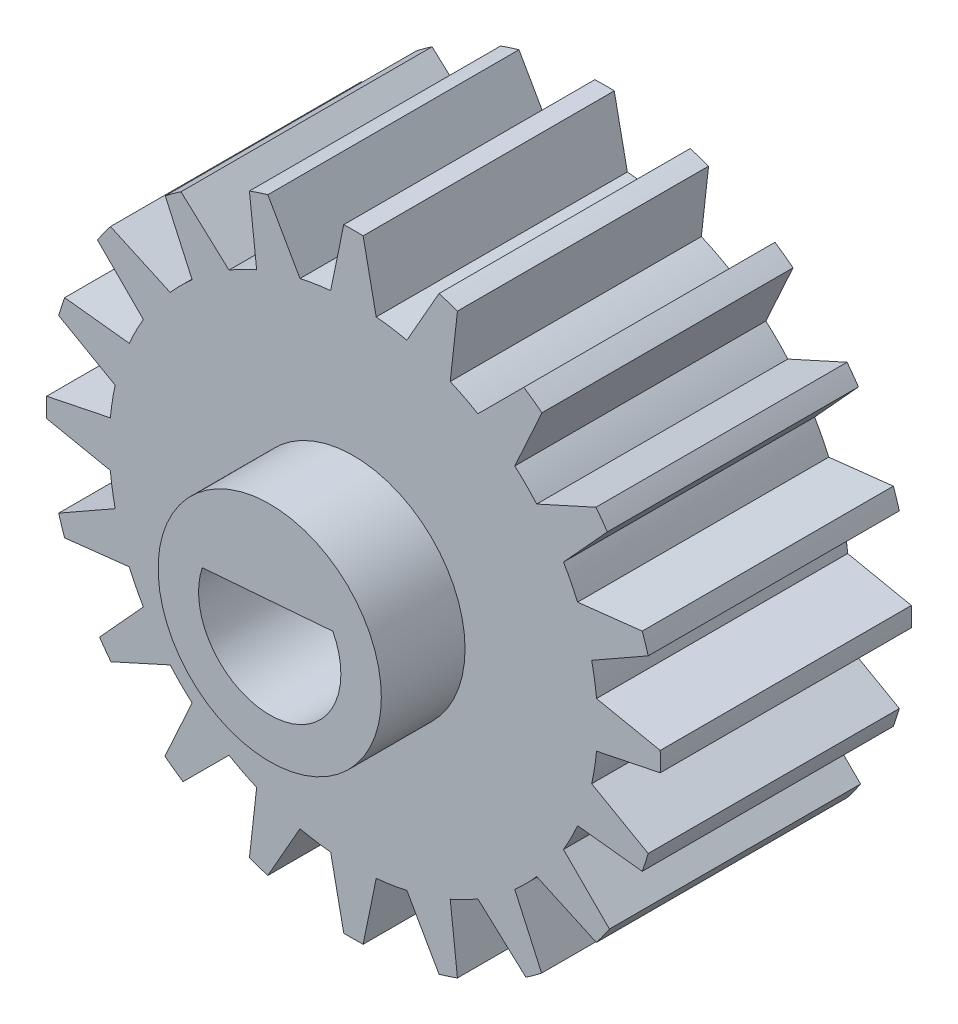
from build123d import *

# Parameters (mm, degrees)
SKETCH_1_R       = 8
EXTRUDE_1_DEPTH  = 24
SKETCH_2_R       = 17.5
SKETCH_2_R_2     = 8
EXTRUDE_2_DEPTH  = 18
EXTRUDE_3_DEPTH  = 18
EXTRUDE_4_DEPTH  = 18
EXTRUDE_5_DEPTH  = 18
EXTRUDE_6_DEPTH  = 18
EXTRUDE_7_DEPTH  = 18
EXTRUDE_8_DEPTH  = 18
EXTRUDE_9_DEPTH  = 18
EXTRUDE_10_DEPTH = 18
EXTRUDE_11_DEPTH = 18
EXTRUDE_12_DEPTH = 18
EXTRUDE_13_DEPTH = 18
EXTRUDE_14_DEPTH = 18
EXTRUDE_15_DEPTH = 18
EXTRUDE_16_DEPTH = 18
EXTRUDE_17_DEPTH = 18
EXTRUDE_18_DEPTH = 18
EXTRUDE_19_DEPTH = 18
EXTRUDE_20_DEPTH = 18
EXTRUDE_21_DEPTH = 18
EXTRUDE_22_DEPTH = 18


with BuildPart() as part:
    # 草图1 → 凸台-拉伸1 (new body)
    with BuildSketch(Plane.XY):
        Circle(SKETCH_1_R)
        with BuildLine():
            Line((4.520101179, 2.361924075), (-4.833937562, 1.62574526))
            ThreePointArc((-4.833937562, 1.62574526), (0.400141388, -5.084278402), (4.520101179, 2.361924075))
        make_face(mode=Mode.SUBTRACT)
    extrude(amount=EXTRUDE_1_DEPTH)

    # 草图2 → 凸台-拉伸2 (add)
    with BuildSketch(Plane.XY):
        Circle(SKETCH_2_R)
        Circle(SKETCH_2_R_2, mode=Mode.SUBTRACT)
    extrude(amount=EXTRUDE_2_DEPTH)

    # 草图3 → 凸台-拉伸3 (add)
    with BuildSketch(Plane.XY):
        with BuildLine():
            Line((17.423652167, 1.632894724), (21.989026862, 0.69476445))
            ThreePointArc((21.989026862, 0.69476445), (22, 0), (21.989026862, -0.69476445))
            Line((21.989026862, -0.69476445), (17.423652167, -1.632894724))
            ThreePointArc((17.423652167, -1.632894724), (17.5, 0), (17.423652167, 1.632894724))
        make_face()
    extrude(amount=EXTRUDE_3_DEPTH)

    # 草图4 → 凸台-拉伸4 (add)
    with BuildSketch(Plane.XY):
        with BuildLine():
            Line((16.066285711, 6.937179791), (20.698113262, 7.455743248))
            ThreePointArc((20.698113262, 7.455743248), (20.923243358, 6.798373876), (21.127501307, 6.134222733))
            Line((21.127501307, 6.134222733), (17.07547015, 3.831229456))
            ThreePointArc((17.07547015, 3.831229456), (16.643489035, 5.407797402), (16.066285711, 6.937179791))
        make_face()
    extrude(amount=EXTRUDE_4_DEPTH)

    # 草图5 → 凸台-拉伸5 (add)
    with BuildSketch(Plane.XY):
        with BuildLine():
            Line((13.13623927, 11.562405366), (17.381124124, 13.486901949))
            ThreePointArc((17.381124124, 13.486901949), (17.798373876, 12.93127555), (18.197868719, 12.362749455))
            Line((18.197868719, 12.362749455), (15.055822144, 8.920326203))
            ThreePointArc((15.055822144, 8.920326203), (14.157797402, 10.286241915), (13.13623927, 11.562405366))
        make_face()
    extrude(amount=EXTRUDE_5_DEPTH)

    # 草图6 → 凸台-拉伸6 (add)
    with BuildSketch(Plane.XY):
        with BuildLine():
            Line((8.920326203, 15.055822144), (12.212561116, 18.348057057))
            ThreePointArc((12.212561116, 18.348057057), (12.870731845, 17.892515435), (13.511927681, 17.413375811))
            Line((13.511927681, 17.413375811), (11.562405366, 13.13623927))
            ThreePointArc((11.562405366, 13.13623927), (10.286241915, 14.157797402), (8.920326203, 15.055822144))
        make_face()
    extrude(amount=EXTRUDE_6_DEPTH)

    # 草图7 → 凸台-拉伸7 (add)
    with BuildSketch(Plane.XY):
        with BuildLine():
            Line((3.831229456, 17.07547015), (6.134222733, 21.127501307))
            ThreePointArc((6.134222733, 21.127501307), (6.798373876, 20.923243358), (7.455743248, 20.698113262))
            Line((7.455743248, 20.698113262), (6.937179791, 16.066285711))
            ThreePointArc((6.937179791, 16.066285711), (5.407797402, 16.643489035), (3.831229456, 17.07547015))
        make_face()
    extrude(amount=EXTRUDE_7_DEPTH)

    # 草图8 → 凸台-拉伸8 (add)
    with BuildSketch(Plane.XY):
        with BuildLine():
            Line((-1.632894724, 17.423652167), (-0.69476445, 21.989026862))
            ThreePointArc((-0.69476445, 21.989026862), (0, 22), (0.69476445, 21.989026862))
            Line((0.69476445, 21.989026862), (1.632894724, 17.423652167))
            ThreePointArc((1.632894724, 17.423652167), (0, 17.5), (-1.632894724, 17.423652167))
        make_face()
    extrude(amount=EXTRUDE_8_DEPTH)

    # 草图9 → 凸台-拉伸9 (add)
    with BuildSketch(Plane.XY):
        with BuildLine():
            Line((-6.937179791, 16.066285711), (-7.455743248, 20.698113262))
            ThreePointArc((-7.455743248, 20.698113262), (-6.798373876, 20.923243358), (-6.134222733, 21.127501307))
            Line((-6.134222733, 21.127501307), (-3.831229456, 17.07547015))
            ThreePointArc((-3.831229456, 17.07547015), (-5.407797402, 16.643489035), (-6.937179791, 16.066285711))
        make_face()
    extrude(amount=EXTRUDE_9_DEPTH)

    # 草图10 → 凸台-拉伸10 (add)
    with BuildSketch(Plane.XY):
        with BuildLine():
            Line((-11.562405366, 13.13623927), (-13.486901949, 17.381124124))
            ThreePointArc((-13.486901949, 17.381124124), (-12.93127555, 17.798373876), (-12.362749455, 18.197868719))
            Line((-12.362749455, 18.197868719), (-8.920326203, 15.055822144))
            ThreePointArc((-8.920326203, 15.055822144), (-10.286241915, 14.157797402), (-11.562405366, 13.13623927))
        make_face()
    extrude(amount=EXTRUDE_10_DEPTH)

    # 草图11 → 凸台-拉伸11 (add)
    with BuildSketch(Plane.XY):
        with BuildLine():
            Line((-15.055822144, 8.920326203), (-18.348057057, 12.212561116))
            ThreePointArc((-18.348057057, 12.212561116), (-17.892515435, 12.870731845), (-17.413375811, 13.511927681))
            Line((-17.413375811, 13.511927681), (-13.13623927, 11.562405366))
            ThreePointArc((-13.13623927, 11.562405366), (-14.157797402, 10.286241915), (-15.055822144, 8.920326203))
        make_face()
    extrude(amount=EXTRUDE_11_DEPTH)

    # 草图12 → 凸台-拉伸12 (add)
    with BuildSketch(Plane.XY):
        with BuildLine():
            Line((-17.07547015, 3.831229456), (-21.127501307, 6.134222733))
            ThreePointArc((-21.127501307, 6.134222733), (-20.923243358, 6.798373876), (-20.698113262, 7.455743248))
            Line((-20.698113262, 7.455743248), (-16.066285711, 6.937179791))
            ThreePointArc((-16.066285711, 6.937179791), (-16.643489035, 5.407797402), (-17.07547015, 3.831229456))
        make_face()
    extrude(amount=EXTRUDE_12_DEPTH)

    # 草图13 → 凸台-拉伸13 (add)
    with BuildSketch(Plane.XY):
        with BuildLine():
            Line((-17.423652167, -1.632894724), (-21.989026862, -0.69476445))
            ThreePointArc((-21.989026862, -0.69476445), (-22, 0), (-21.989026862, 0.69476445))
            Line((-21.989026862, 0.69476445), (-17.423652167, 1.632894724))
            ThreePointArc((-17.423652167, 1.632894724), (-17.5, 0), (-17.423652167, -1.632894724))
        make_face()
    extrude(amount=EXTRUDE_13_DEPTH)

    # 草图14 → 凸台-拉伸14 (add)
    with BuildSketch(Plane.XY):
        with BuildLine():
            Line((-16.066285711, -6.937179791), (-20.698113262, -7.455743248))
            ThreePointArc((-20.698113262, -7.455743248), (-20.923243358, -6.798373876), (-21.127501307, -6.134222733))
            Line((-21.127501307, -6.134222733), (-17.07547015, -3.831229456))
            ThreePointArc((-17.07547015, -3.831229456), (-16.643489035, -5.407797402), (-16.066285711, -6.937179791))
        make_face()
    extrude(amount=EXTRUDE_14_DEPTH)

    # 草图15 → 凸台-拉伸15 (add)
    with BuildSketch(Plane.XY):
        with BuildLine():
            Line((-13.13623927, -11.562405366), (-17.381124124, -13.486901949))
            ThreePointArc((-17.381124124, -13.486901949), (-17.798373876, -12.93127555), (-18.197868719, -12.362749455))
            Line((-18.197868719, -12.362749455), (-15.055822144, -8.920326203))
            ThreePointArc((-15.055822144, -8.920326203), (-14.157797402, -10.286241915), (-13.13623927, -11.562405366))
        make_face()
    extrude(amount=EXTRUDE_15_DEPTH)

    # 草图16 → 凸台-拉伸16 (add)
    with BuildSketch(Plane.XY):
        with BuildLine():
            Line((-8.920326203, -15.055822144), (-12.212561116, -18.348057057))
            ThreePointArc((-12.212561116, -18.348057057), (-12.870731845, -17.892515435), (-13.511927681, -17.413375811))
            Line((-13.511927681, -17.413375811), (-11.562405366, -13.13623927))
            ThreePointArc((-11.562405366, -13.13623927), (-10.286241915, -14.157797402), (-8.920326203, -15.055822144))
        make_face()
    extrude(amount=EXTRUDE_16_DEPTH)

    # 草图17 → 凸台-拉伸17 (add)
    with BuildSketch(Plane.XY):
        with BuildLine():
            Line((-3.831229456, -17.07547015), (-6.134222733, -21.127501307))
            ThreePointArc((-6.134222733, -21.127501307), (-6.798373876, -20.923243358), (-7.455743248, -20.698113262))
            Line((-7.455743248, -20.698113262), (-6.937179791, -16.066285711))
            ThreePointArc((-6.937179791, -16.066285711), (-5.407797402, -16.643489035), (-3.831229456, -17.07547015))
        make_face()
    extrude(amount=EXTRUDE_17_DEPTH)

    # 草图18 → 凸台-拉伸18 (add)
    with BuildSketch(Plane.XY):
        with BuildLine():
            Line((1.632894724, -17.423652167), (0.69476445, -21.989026862))
            ThreePointArc((0.69476445, -21.989026862), (0, -22), (-0.69476445, -21.989026862))
            Line((-0.69476445, -21.989026862), (-1.632894724, -17.423652167))
            ThreePointArc((-1.632894724, -17.423652167), (0, -17.5), (1.632894724, -17.423652167))
        make_face()
    extrude(amount=EXTRUDE_18_DEPTH)

    # 草图19 → 凸台-拉伸19 (add)
    with BuildSketch(Plane.XY):
        with BuildLine():
            Line((6.937179791, -16.066285711), (7.455743248, -20.698113262))
            ThreePointArc((7.455743248, -20.698113262), (6.798373876, -20.923243358), (6.134222733, -21.127501307))
            Line((6.134222733, -21.127501307), (3.831229456, -17.07547015))
            ThreePointArc((3.831229456, -17.07547015), (5.407797402, -16.643489035), (6.937179791, -16.066285711))
        make_face()
    extrude(amount=EXTRUDE_19_DEPTH)

    # 草图20 → 凸台-拉伸20 (add)
    with BuildSketch(Plane.XY):
        with BuildLine():
            Line((11.562405366, -13.13623927), (13.486901949, -17.381124124))
            ThreePointArc((13.486901949, -17.381124124), (12.93127555, -17.798373876), (12.362749455, -18.197868719))
            Line((12.362749455, -18.197868719), (8.920326203, -15.055822144))
            ThreePointArc((8.920326203, -15.055822144), (10.286241915, -14.157797402), (11.562405366, -13.13623927))
        make_face()
    extrude(amount=EXTRUDE_20_DEPTH)

    # 草图21 → 凸台-拉伸21 (add)
    with BuildSketch(Plane.XY):
        with BuildLine():
            Line((15.055822144, -8.920326203), (18.348057057, -12.212561116))
            ThreePointArc((18.348057057, -12.212561116), (17.892515435, -12.870731845), (17.413375811, -13.511927681))
            Line((17.413375811, -13.511927681), (13.13623927, -11.562405366))
            ThreePointArc((13.13623927, -11.562405366), (14.157797402, -10.286241915), (15.055822144, -8.920326203))
        make_face()
    extrude(amount=EXTRUDE_21_DEPTH)

    # 草图22 → 凸台-拉伸22 (add)
    with BuildSketch(Plane.XY):
        with BuildLine():
            Line((17.07547015, -3.831229456), (21.127501307, -6.134222733))
            ThreePointArc((21.127501307, -6.134222733), (20.923243358, -6.798373876), (20.698113262, -7.455743248))
            Line((20.698113262, -7.455743248), (16.066285711, -6.937179791))
            ThreePointArc((16.066285711, -6.937179791), (16.643489035, -5.407797402), (17.07547015, -3.831229456))
        make_face()
    extrude(amount=EXTRUDE_22_DEPTH)


solid = part.part
